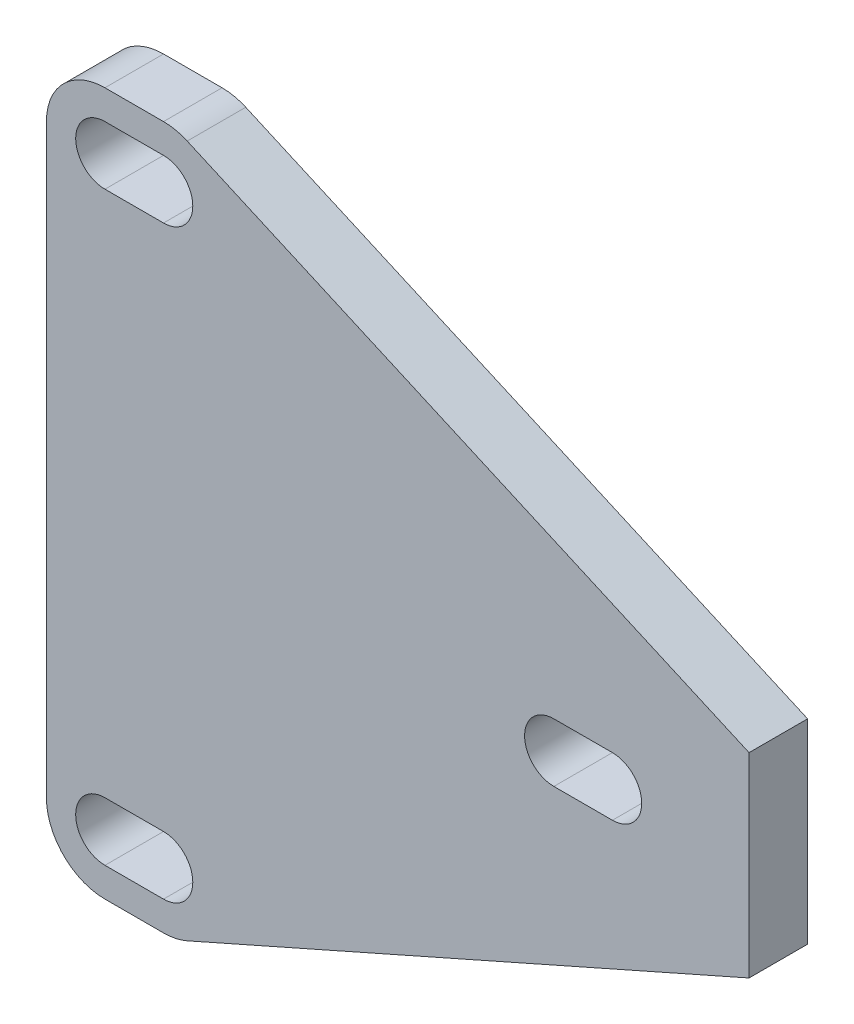
from build123d import *

# Parameters (mm, degrees)
BOSS_EXTRUDE1_DEPTH = 3


with BuildPart() as part:
    # Sketch1 → Boss-Extrude1 (new body)
    with BuildSketch(Plane.XY):
        with BuildLine():
            Line((31.5, -5), (31.5, 5))
            Line((31.5, 5), (2.714404574, 17.743213723))
            ThreePointArc((2.714404574, 17.743213723), (2.120628243, 17.935101461), (1.5, 18))
            Line((1.5, 18), (-1.5, 18))
            ThreePointArc((-1.5, 18), (-3.621320344, 17.121320344), (-4.5, 15))
            Line((-4.5, 15), (-4.5, -15))
            ThreePointArc((-4.5, -15), (-3.621320344, -17.121320344), (-1.5, -18))
            Line((-1.5, -18), (1.5, -18))
            ThreePointArc((1.5, -18), (2.120628243, -17.935101461), (2.714404574, -17.743213723))
            Line((2.714404574, -17.743213723), (31.5, -5))
        make_face()
        with BuildLine():
            Line((21.5, -1.5), (24.5, -1.5))
            ThreePointArc((24.5, -1.5), (26, 0), (24.5, 1.5))
            Line((24.5, 1.5), (21.5, 1.5))
            ThreePointArc((21.5, 1.5), (20, 0), (21.5, -1.5))
        make_face(mode=Mode.SUBTRACT)
        with BuildLine():
            Line((-1.5, 16.5), (1.5, 16.5))
            ThreePointArc((1.5, 16.5), (3, 15), (1.5, 13.5))
            Line((1.5, 13.5), (-1.5, 13.5))
            ThreePointArc((-1.5, 13.5), (-3, 15), (-1.5, 16.5))
        make_face(mode=Mode.SUBTRACT)
        with BuildLine():
            Line((1.5, -13.5), (-1.5, -13.5))
            ThreePointArc((-1.5, -13.5), (-3, -15), (-1.5, -16.5))
            Line((-1.5, -16.5), (1.5, -16.5))
            ThreePointArc((1.5, -16.5), (3, -15), (1.5, -13.5))
        make_face(mode=Mode.SUBTRACT)
    extrude(amount=BOSS_EXTRUDE1_DEPTH)


solid = part.part
